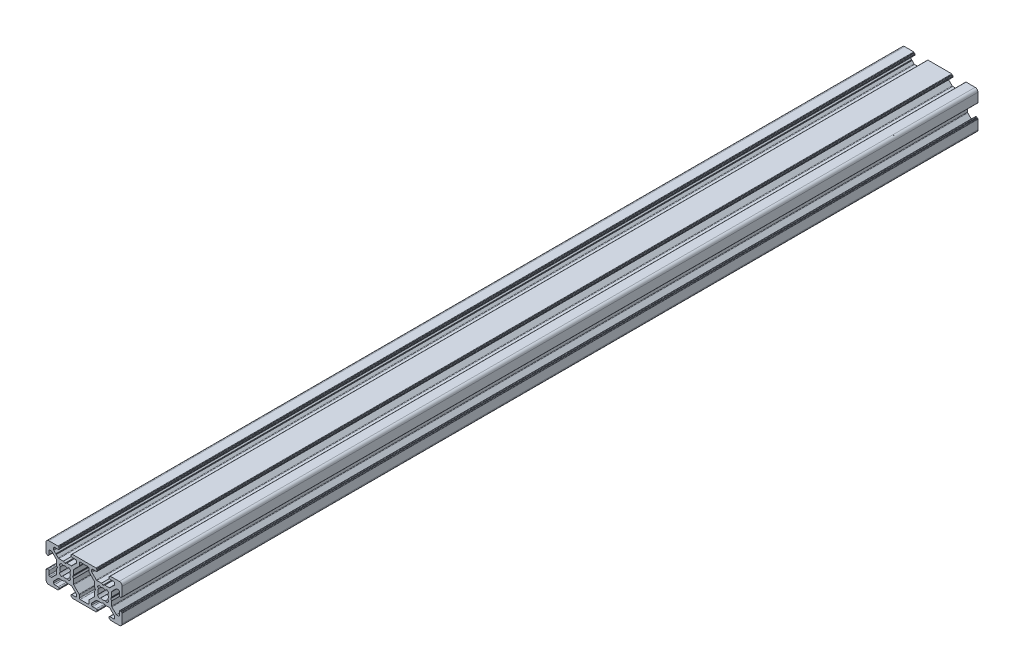
from build123d import *

# Parameters (mm, degrees)
EXTRUDE_830_DEPTH = 224.75


with BuildPart() as part:
    # Model → Extrude 830 (new, symmetric)
    with BuildSketch(Plane.XY):
        with BuildLine():
            Line((-14.790380224, 5.709619137), (-14.842144033, 5.902804302))
            Line((-14.842144033, 5.902804302), (-15.853552994, 6.914213263))
            ThreePointArc((-15.853552994, 6.914213263), (-15.96193937, 7.076424937), (-15.999999604, 7.267766654))
            Line((-15.999999604, 7.267766654), (-15.999999604, 7.999999642))
            ThreePointArc((-15.999999604, 7.999999642), (-15.853552994, 8.353553033), (-15.499999604, 8.499999642))
            Line((-15.499999604, 8.499999642), (-13.599999999, 8.499999642))
            ThreePointArc((-13.599999999, 8.499999642), (-13.246446608, 8.646446251), (-13.099999999, 8.999999642))
            Line((-13.099999999, 8.999999642), (-13.099999999, 9.299999969))
            ThreePointArc((-13.099999999, 9.299999969), (-13.158578643, 9.441421325), (-13.299999999, 9.499999969))
            Line((-13.299999999, 9.499999969), (-13.350000227, 9.499999969))
            ThreePointArc((-13.350000227, 9.499999969), (-13.491421583, 9.558578612), (-13.550000227, 9.699999969))
            Line((-13.550000227, 9.699999969), (-13.550000227, 9.799999969))
            ThreePointArc((-13.550000227, 9.799999969), (-13.60857887, 9.941421325), (-13.750000227, 9.999999969))
            Line((-13.750000227, 9.999999969), (-18.499999999, 9.999999969))
            ThreePointArc((-18.499999999, 9.999999969), (-19.560660171, 9.56066014), (-19.999999999, 8.499999969))
            Line((-19.999999999, 8.499999969), (-19.999999999, 3.750000196))
            ThreePointArc((-19.999999999, 3.750000196), (-19.941421355, 3.60857884), (-19.799999999, 3.550000196))
            Line((-19.799999999, 3.550000196), (-19.699999999, 3.550000196))
            ThreePointArc((-19.699999999, 3.550000196), (-19.558578643, 3.491421552), (-19.499999999, 3.350000196))
            Line((-19.499999999, 3.350000196), (-19.499999999, 3.299999969))
            ThreePointArc((-19.499999999, 3.299999969), (-19.441421355, 3.158578612), (-19.299999999, 3.099999969))
            Line((-19.299999999, 3.099999969), (-18.999999672, 3.099999969))
            ThreePointArc((-18.999999672, 3.099999969), (-18.646446282, 3.246446578), (-18.499999672, 3.599999969))
            Line((-18.499999672, 3.599999969), (-18.499999672, 5.500000655))
            ThreePointArc((-18.499999672, 5.500000655), (-18.353553063, 5.853554045), (-17.999999672, 6.000000655))
            Line((-17.999999672, 6.000000655), (-17.267766625, 6.000000655))
            ThreePointArc((-17.267766625, 6.000000655), (-17.076424898, 5.961940416), (-16.914213218, 5.853554028))
            Line((-16.914213218, 5.853554028), (-14.646446591, 3.585787181))
            ThreePointArc((-14.646446591, 3.585787181), (-14.538060228, 3.423575512), (-14.499999999, 3.232233807))
            Line((-14.499999999, 3.232233807), (-14.499999999, 0.95359028))
            ThreePointArc((-14.499999999, 0.95359028), (-14.493185165, 0.901826474), (-14.473205082, 0.853590285))
            Line((-14.473205082, 0.853590285), (-14.038119561, 0.100000013))
            ThreePointArc((-14.038119561, 0.100000013), (-14.011324631, -3.1e-08), (-14.038119561, -0.100000076))
            Line((-14.038119561, -0.100000076), (-14.473205082, -0.853590347))
            ThreePointArc((-14.473205082, -0.853590347), (-14.493185165, -0.901826537), (-14.499999999, -0.953590343))
            Line((-14.499999999, -0.953590343), (-14.499999999, -3.23223387))
            ThreePointArc((-14.499999999, -3.23223387), (-14.538060228, -3.423575575), (-14.646446591, -3.585787243))
            Line((-14.646446591, -3.585787243), (-16.914213218, -5.853554091))
            ThreePointArc((-16.914213218, -5.853554091), (-17.076424898, -5.961940479), (-17.267766625, -6.000000717))
            Line((-17.267766625, -6.000000717), (-17.999999672, -6.000000717))
            ThreePointArc((-17.999999672, -6.000000717), (-18.353553063, -5.853554108), (-18.499999672, -5.500000717))
            Line((-18.499999672, -5.500000717), (-18.499999672, -3.600000031))
            ThreePointArc((-18.499999672, -3.600000031), (-18.646446282, -3.246446641), (-18.999999672, -3.100000031))
            Line((-18.999999672, -3.100000031), (-19.299999999, -3.100000031))
            ThreePointArc((-19.299999999, -3.100000031), (-19.441421355, -3.158578675), (-19.499999999, -3.300000031))
            Line((-19.499999999, -3.300000031), (-19.499999999, -3.350000259))
            ThreePointArc((-19.499999999, -3.350000259), (-19.558578643, -3.491421615), (-19.699999999, -3.550000259))
            Line((-19.699999999, -3.550000259), (-19.799999999, -3.550000259))
            ThreePointArc((-19.799999999, -3.550000259), (-19.941421355, -3.608578903), (-19.999999999, -3.750000259))
            Line((-19.999999999, -3.750000259), (-19.999999999, -8.500000031))
            ThreePointArc((-19.999999999, -8.500000031), (-19.560660171, -9.560660203), (-18.499999999, -10.000000031))
            Line((-18.499999999, -10.000000031), (-13.750000227, -10.000000031))
            ThreePointArc((-13.750000227, -10.000000031), (-13.60857887, -9.941421388), (-13.550000227, -9.800000031))
            Line((-13.550000227, -9.800000031), (-13.550000227, -9.700000031))
            ThreePointArc((-13.550000227, -9.700000031), (-13.491421583, -9.558578675), (-13.350000227, -9.500000031))
            Line((-13.350000227, -9.500000031), (-13.299999999, -9.500000031))
            ThreePointArc((-13.299999999, -9.500000031), (-13.158578643, -9.441421388), (-13.099999999, -9.300000031))
            Line((-13.099999999, -9.300000031), (-13.099999999, -8.999999705))
            ThreePointArc((-13.099999999, -8.999999705), (-13.246446608, -8.646446314), (-13.599999999, -8.499999705))
            Line((-13.599999999, -8.499999705), (-15.499999604, -8.499999705))
            ThreePointArc((-15.499999604, -8.499999705), (-15.853552994, -8.353553095), (-15.999999604, -7.999999705))
            Line((-15.999999604, -7.999999705), (-15.999999604, -7.267766658))
            ThreePointArc((-15.999999604, -7.267766658), (-15.96193937, -7.076424942), (-15.853552994, -6.914213267))
            Line((-15.853552994, -6.914213267), (-13.585786098, -4.646446371))
            ThreePointArc((-13.585786098, -4.646446371), (-13.423574424, -4.538059995), (-13.232232708, -4.499999762))
            Line((-13.232232708, -4.499999762), (-10.953589301, -4.499999762))
            ThreePointArc((-10.953589301, -4.499999762), (-10.901825489, -4.493184926), (-10.853589297, -4.47320484))
            Line((-10.853589297, -4.47320484), (-10.099999968, -4.038119814))
            ThreePointArc((-10.099999968, -4.038119814), (-9.999999999, -4.011324902), (-9.90000003, -4.038119814))
            Line((-9.90000003, -4.038119814), (-9.146410702, -4.47320484))
            ThreePointArc((-9.146410702, -4.47320484), (-9.098174509, -4.493184926), (-9.046410697, -4.499999762))
            Line((-9.046410697, -4.499999762), (-6.767767291, -4.499999762))
            ThreePointArc((-6.767767291, -4.499999762), (-6.576425574, -4.538059995), (-6.4142139, -4.646446371))
            Line((-6.4142139, -4.646446371), (-4.146447004, -6.914213267))
            ThreePointArc((-4.146447004, -6.914213267), (-4.038060628, -7.076424942), (-4.000000394, -7.267766658))
            Line((-4.000000394, -7.267766658), (-4.000000394, -7.999999646))
            ThreePointArc((-4.000000394, -7.999999646), (-4.146447004, -8.353553037), (-4.500000394, -8.499999646))
            Line((-4.500000394, -8.499999646), (-6.399999999, -8.499999646))
            ThreePointArc((-6.399999999, -8.499999646), (-6.75355339, -8.646446255), (-6.899999999, -8.999999646))
            Line((-6.899999999, -8.999999646), (-6.899999999, -9.299999973))
            ThreePointArc((-6.899999999, -9.299999973), (-6.841421355, -9.441421329), (-6.699999999, -9.499999973))
            Line((-6.699999999, -9.499999973), (-6.649999772, -9.499999973))
            ThreePointArc((-6.649999772, -9.499999973), (-6.508578415, -9.558578616), (-6.449999772, -9.699999973))
            Line((-6.449999772, -9.699999973), (-6.449999772, -9.799999973))
            ThreePointArc((-6.449999772, -9.799999973), (-6.391421128, -9.941421329), (-6.249999772, -9.999999973))
            Line((-6.249999772, -9.999999973), (6.249999773, -9.999999973))
            ThreePointArc((6.249999773, -9.999999973), (6.39142113, -9.941421329), (6.449999773, -9.799999973))
            Line((6.449999773, -9.799999973), (6.449999773, -9.699999973))
            ThreePointArc((6.449999773, -9.699999973), (6.508578417, -9.558578616), (6.649999773, -9.499999973))
            Line((6.649999773, -9.499999973), (6.700000001, -9.499999973))
            ThreePointArc((6.700000001, -9.499999973), (6.841421357, -9.441421329), (6.900000001, -9.299999973))
            Line((6.900000001, -9.299999973), (6.900000001, -8.999999646))
            ThreePointArc((6.900000001, -8.999999646), (6.753553392, -8.646446255), (6.400000001, -8.499999646))
            Line((6.400000001, -8.499999646), (4.500000396, -8.499999646))
            ThreePointArc((4.500000396, -8.499999646), (4.146447006, -8.353553037), (4.000000396, -7.999999646))
            Line((4.000000396, -7.999999646), (4.000000396, -7.267766658))
            ThreePointArc((4.000000396, -7.267766658), (4.03806063, -7.076424942), (4.146447006, -6.914213267))
            Line((4.146447006, -6.914213267), (6.414213902, -4.646446371))
            ThreePointArc((6.414213902, -4.646446371), (6.576425576, -4.538059995), (6.767767292, -4.499999762))
            Line((6.767767292, -4.499999762), (9.046410699, -4.499999762))
            ThreePointArc((9.046410699, -4.499999762), (9.098174511, -4.493184926), (9.146410703, -4.47320484))
            Line((9.146410703, -4.47320484), (9.900000032, -4.038119814))
            ThreePointArc((9.900000032, -4.038119814), (10.000000001, -4.011324902), (10.09999997, -4.038119814))
            Line((10.09999997, -4.038119814), (10.853589298, -4.47320484))
            ThreePointArc((10.853589298, -4.47320484), (10.901825491, -4.493184926), (10.953589303, -4.499999762))
            Line((10.953589303, -4.499999762), (13.232232709, -4.499999762))
            ThreePointArc((13.232232709, -4.499999762), (13.423574426, -4.538059995), (13.5857861, -4.646446371))
            Line((13.5857861, -4.646446371), (15.853552996, -6.914213267))
            ThreePointArc((15.853552996, -6.914213267), (15.961939372, -7.076424942), (15.999999606, -7.267766658))
            Line((15.999999606, -7.267766658), (15.999999606, -7.999999705))
            ThreePointArc((15.999999606, -7.999999705), (15.853552996, -8.353553095), (15.499999606, -8.499999705))
            Line((15.499999606, -8.499999705), (13.600000001, -8.499999705))
            ThreePointArc((13.600000001, -8.499999705), (13.24644661, -8.646446314), (13.100000001, -8.999999705))
            Line((13.100000001, -8.999999705), (13.100000001, -9.300000031))
            ThreePointArc((13.100000001, -9.300000031), (13.158578645, -9.441421388), (13.300000001, -9.500000031))
            Line((13.300000001, -9.500000031), (13.350000228, -9.500000031))
            ThreePointArc((13.350000228, -9.500000031), (13.491421585, -9.558578675), (13.550000228, -9.700000031))
            Line((13.550000228, -9.700000031), (13.550000228, -9.800000031))
            ThreePointArc((13.550000228, -9.800000031), (13.608578872, -9.941421388), (13.750000228, -10.000000031))
            Line((13.750000228, -10.000000031), (18.500000001, -10.000000031))
            ThreePointArc((18.500000001, -10.000000031), (19.560660173, -9.560660203), (20.000000001, -8.500000031))
            Line((20.000000001, -8.500000031), (20.000000001, -3.750000259))
            ThreePointArc((20.000000001, -3.750000259), (19.941421357, -3.608578903), (19.800000001, -3.550000259))
            Line((19.800000001, -3.550000259), (19.700000001, -3.550000259))
            ThreePointArc((19.700000001, -3.550000259), (19.558578645, -3.491421615), (19.500000001, -3.350000259))
            Line((19.500000001, -3.350000259), (19.500000001, -3.300000031))
            ThreePointArc((19.500000001, -3.300000031), (19.441421357, -3.158578675), (19.300000001, -3.100000031))
            Line((19.300000001, -3.100000031), (18.999999674, -3.100000031))
            ThreePointArc((18.999999674, -3.100000031), (18.646446284, -3.246446641), (18.499999674, -3.600000031))
            Line((18.499999674, -3.600000031), (18.499999674, -5.500000717))
            ThreePointArc((18.499999674, -5.500000717), (18.353553065, -5.853554108), (17.999999674, -6.000000717))
            Line((17.999999674, -6.000000717), (17.267766627, -6.000000717))
            ThreePointArc((17.267766627, -6.000000717), (17.0764249, -5.961940479), (16.914213219, -5.853554091))
            Line((16.914213219, -5.853554091), (14.646446593, -3.585787243))
            ThreePointArc((14.646446593, -3.585787243), (14.53806023, -3.423575575), (14.500000001, -3.23223387))
            Line((14.500000001, -3.23223387), (14.500000001, -0.953590343))
            ThreePointArc((14.500000001, -0.953590343), (14.493185167, -0.901826537), (14.473205084, -0.853590347))
            Line((14.473205084, -0.853590347), (14.038119563, -0.100000076))
            ThreePointArc((14.038119563, -0.100000076), (14.011324633, -3.1e-08), (14.038119563, 0.100000013))
            Line((14.038119563, 0.100000013), (14.473205084, 0.853590285))
            ThreePointArc((14.473205084, 0.853590285), (14.493185167, 0.901826474), (14.500000001, 0.95359028))
            Line((14.500000001, 0.95359028), (14.500000001, 3.232233807))
            ThreePointArc((14.500000001, 3.232233807), (14.53806023, 3.423575512), (14.646446593, 3.585787181))
            Line((14.646446593, 3.585787181), (16.914213219, 5.853554028))
            ThreePointArc((16.914213219, 5.853554028), (17.0764249, 5.961940416), (17.267766627, 6.000000655))
            Line((17.267766627, 6.000000655), (17.999999674, 6.000000655))
            ThreePointArc((17.999999674, 6.000000655), (18.353553065, 5.853554045), (18.499999674, 5.500000655))
            Line((18.499999674, 5.500000655), (18.499999674, 3.599999969))
            ThreePointArc((18.499999674, 3.599999969), (18.646446284, 3.246446578), (18.999999674, 3.099999969))
            Line((18.999999674, 3.099999969), (19.300000001, 3.099999969))
            ThreePointArc((19.300000001, 3.099999969), (19.441421357, 3.158578612), (19.500000001, 3.299999969))
            Line((19.500000001, 3.299999969), (19.500000001, 3.350000196))
            ThreePointArc((19.500000001, 3.350000196), (19.558578645, 3.491421552), (19.700000001, 3.550000196))
            Line((19.700000001, 3.550000196), (19.800000001, 3.550000196))
            ThreePointArc((19.800000001, 3.550000196), (19.941421357, 3.60857884), (20.000000001, 3.750000196))
            Line((20.000000001, 3.750000196), (20.000000001, 8.499999969))
            ThreePointArc((20.000000001, 8.499999969), (19.560660173, 9.56066014), (18.500000001, 9.999999969))
            Line((18.500000001, 9.999999969), (13.750000228, 9.999999969))
            ThreePointArc((13.750000228, 9.999999969), (13.608578872, 9.941421325), (13.550000228, 9.799999969))
            Line((13.550000228, 9.799999969), (13.550000228, 9.699999969))
            ThreePointArc((13.550000228, 9.699999969), (13.491421585, 9.558578612), (13.350000228, 9.499999969))
            Line((13.350000228, 9.499999969), (13.300000001, 9.499999969))
            ThreePointArc((13.300000001, 9.499999969), (13.158578645, 9.441421325), (13.100000001, 9.299999969))
            Line((13.100000001, 9.299999969), (13.100000001, 8.999999642))
            ThreePointArc((13.100000001, 8.999999642), (13.24644661, 8.646446251), (13.600000001, 8.499999642))
            Line((13.600000001, 8.499999642), (15.499999606, 8.499999642))
            ThreePointArc((15.499999606, 8.499999642), (15.853552996, 8.353553033), (15.999999606, 7.999999642))
            Line((15.999999606, 7.999999642), (15.999999606, 7.267766654))
            ThreePointArc((15.999999606, 7.267766654), (15.961939372, 7.076424937), (15.853552996, 6.914213263))
            Line((15.853552996, 6.914213263), (13.5857861, 4.646446367))
            ThreePointArc((13.5857861, 4.646446367), (13.423574426, 4.538059991), (13.232232709, 4.499999757))
            Line((13.232232709, 4.499999757), (10.953589303, 4.499999757))
            ThreePointArc((10.953589303, 4.499999757), (10.901825491, 4.493184922), (10.853589298, 4.473204836))
            Line((10.853589298, 4.473204836), (10.09999997, 4.03811981))
            ThreePointArc((10.09999997, 4.03811981), (10.000000001, 4.011324897), (9.900000032, 4.03811981))
            Line((9.900000032, 4.03811981), (9.146410703, 4.473204836))
            ThreePointArc((9.146410703, 4.473204836), (9.098174511, 4.493184922), (9.046410699, 4.499999757))
            Line((9.046410699, 4.499999757), (6.767767292, 4.499999757))
            ThreePointArc((6.767767292, 4.499999757), (6.576425576, 4.538059991), (6.414213902, 4.646446367))
            Line((6.414213902, 4.646446367), (4.146447006, 6.914213263))
            ThreePointArc((4.146447006, 6.914213263), (4.03806063, 7.076424937), (4.000000396, 7.267766654))
            Line((4.000000396, 7.267766654), (4.000000396, 7.999999734))
            ThreePointArc((4.000000396, 7.999999734), (4.146446629, 8.35355271), (4.499999315, 8.499999642))
            Line((4.499999315, 8.499999642), (6.400000001, 8.499999642))
            ThreePointArc((6.400000001, 8.499999642), (6.753553392, 8.646446251), (6.900000001, 8.999999642))
            Line((6.900000001, 8.999999642), (6.900000001, 9.299999969))
            ThreePointArc((6.900000001, 9.299999969), (6.841421357, 9.441421325), (6.700000001, 9.499999969))
            Line((6.700000001, 9.499999969), (6.649999773, 9.499999969))
            ThreePointArc((6.649999773, 9.499999969), (6.508578417, 9.558578612), (6.449999773, 9.699999969))
            Line((6.449999773, 9.699999969), (6.449999773, 9.799999969))
            ThreePointArc((6.449999773, 9.799999969), (6.39142113, 9.941421325), (6.249999773, 9.999999969))
            Line((6.249999773, 9.999999969), (-6.249999772, 9.999999969))
            ThreePointArc((-6.249999772, 9.999999969), (-6.391421128, 9.941421325), (-6.449999772, 9.799999969))
            Line((-6.449999772, 9.799999969), (-6.449999772, 9.699999969))
            ThreePointArc((-6.449999772, 9.699999969), (-6.508578415, 9.558578612), (-6.649999772, 9.499999969))
            Line((-6.649999772, 9.499999969), (-6.699999999, 9.499999969))
            ThreePointArc((-6.699999999, 9.499999969), (-6.841421355, 9.441421325), (-6.899999999, 9.299999969))
            Line((-6.899999999, 9.299999969), (-6.899999999, 8.999999642))
            ThreePointArc((-6.899999999, 8.999999642), (-6.75355339, 8.646446251), (-6.399999999, 8.499999642))
            Line((-6.399999999, 8.499999642), (-4.500000302, 8.499999642))
            ThreePointArc((-4.500000302, 8.499999642), (-4.146446965, 8.353553048), (-4.000000394, 7.999999701))
            Line((-4.000000394, 7.999999701), (-4.000000394, 7.267766654))
            ThreePointArc((-4.000000394, 7.267766654), (-4.038060628, 7.076424937), (-4.146447004, 6.914213263))
            Line((-4.146447004, 6.914213263), (-6.4142139, 4.646446367))
            ThreePointArc((-6.4142139, 4.646446367), (-6.576425574, 4.538059991), (-6.767767291, 4.499999757))
            Line((-6.767767291, 4.499999757), (-9.046410697, 4.499999757))
            ThreePointArc((-9.046410697, 4.499999757), (-9.098174509, 4.493184922), (-9.146410702, 4.473204836))
            Line((-9.146410702, 4.473204836), (-9.90000003, 4.03811981))
            ThreePointArc((-9.90000003, 4.03811981), (-9.999999999, 4.011324897), (-10.099999968, 4.03811981))
            Line((-10.099999968, 4.03811981), (-10.853589297, 4.473204836))
            ThreePointArc((-10.853589297, 4.473204836), (-10.901825489, 4.493184922), (-10.953589301, 4.499999757))
            Line((-10.953589301, 4.499999757), (-13.232232708, 4.499999757))
            ThreePointArc((-13.232232708, 4.499999757), (-13.423574424, 4.538059991), (-13.585786098, 4.646446367))
            Line((-13.585786098, 4.646446367), (-14.597195059, 5.657855328))
            Line((-14.597195059, 5.657855328), (-14.790380224, 5.709619137))
        make_face()
        with BuildLine():
            Line((8.090069039, 2.992174922), (8.741814684, 2.445295392))
            ThreePointArc((8.741814684, 2.445295392), (10.000000001, 2.749999969), (11.258185318, 2.445295392))
            Line((11.258185318, 2.445295392), (11.909930962, 2.992174922))
            ThreePointArc((11.909930962, 2.992174922), (12.508410486, 2.511737229), (12.989640963, 1.913894988))
            Line((12.989640963, 1.913894988), (12.445295363, 1.258185405))
            ThreePointArc((12.445295363, 1.258185405), (12.750000001, -3.1e-08), (12.445295363, -1.258185468))
            Line((12.445295363, -1.258185468), (12.989640963, -1.913895051))
            ThreePointArc((12.989640963, -1.913895051), (12.508410486, -2.511737292), (11.909930962, -2.992174985))
            Line((11.909930962, -2.992174985), (11.258185318, -2.445295455))
            ThreePointArc((11.258185318, -2.445295455), (10.000000001, -2.750000031), (8.741814684, -2.445295455))
            Line((8.741814684, -2.445295455), (8.090069039, -2.992174985))
            ThreePointArc((8.090069039, -2.992174985), (7.491589516, -2.511737292), (7.010359039, -1.913895051))
            Line((7.010359039, -1.913895051), (7.554704639, -1.258185468))
            ThreePointArc((7.554704639, -1.258185468), (7.250000001, -3.1e-08), (7.554704639, 1.258185405))
            Line((7.554704639, 1.258185405), (7.010359039, 1.913894988))
            ThreePointArc((7.010359039, 1.913894988), (7.491589516, 2.511737229), (8.090069039, 2.992174922))
        make_face(mode=Mode.SUBTRACT)
        with BuildLine():
            Line((-7.010359037, 1.913894988), (-7.554704637, 1.258185405))
            ThreePointArc((-7.554704637, 1.258185405), (-7.249999999, -3.1e-08), (-7.554704637, -1.258185468))
            Line((-7.554704637, -1.258185468), (-7.010359037, -1.913895051))
            ThreePointArc((-7.010359037, -1.913895051), (-7.491589514, -2.511737292), (-8.090069038, -2.992174985))
            Line((-8.090069038, -2.992174985), (-8.741814682, -2.445295455))
            ThreePointArc((-8.741814682, -2.445295455), (-9.999999999, -2.750000031), (-11.258185316, -2.445295455))
            Line((-11.258185316, -2.445295455), (-11.909930961, -2.992174985))
            ThreePointArc((-11.909930961, -2.992174985), (-12.508410484, -2.511737292), (-12.989640961, -1.913895051))
            Line((-12.989640961, -1.913895051), (-12.445295361, -1.258185468))
            ThreePointArc((-12.445295361, -1.258185468), (-12.749999999, -3.1e-08), (-12.445295361, 1.258185405))
            Line((-12.445295361, 1.258185405), (-12.989640961, 1.913894988))
            ThreePointArc((-12.989640961, 1.913894988), (-12.508410484, 2.511737229), (-11.909930961, 2.992174922))
            Line((-11.909930961, 2.992174922), (-11.258185316, 2.445295392))
            ThreePointArc((-11.258185316, 2.445295392), (-9.999999999, 2.749999969), (-8.741814682, 2.445295392))
            Line((-8.741814682, 2.445295392), (-8.090069038, 2.992174922))
            ThreePointArc((-8.090069038, 2.992174922), (-7.491589514, 2.511737229), (-7.010359037, 1.913894988))
        make_face(mode=Mode.SUBTRACT)
        with BuildLine():
            Line((5.526682017, 0.85378582), (5.961880479, 0.100000015))
            ThreePointArc((5.961880479, 0.100000015), (5.988675404, 4e-09), (5.961880483, -0.100000009))
            Line((5.961880483, -0.100000009), (5.526682014, -0.853785889))
            ThreePointArc((5.526682014, -0.853785889), (5.50670193, -0.902022079), (5.499887096, -0.953785887))
            Line((5.499887096, -0.953785887), (5.499887096, -3.232425683))
            ThreePointArc((5.499887096, -3.232425683), (5.461825468, -3.423770765), (5.353435334, -3.585984226))
            Line((5.353435334, -3.585984226), (2.646451763, -6.292888902))
            ThreePointArc((2.646451763, -6.292888902), (2.538061629, -6.455102363), (2.500000001, -6.646447445))
            Line((2.500000001, -6.646447445), (2.500000001, -7.99999982))
            ThreePointArc((2.500000001, -7.99999982), (2.353553392, -8.35355321), (2.000000001, -8.49999982))
            Line((2.000000001, -8.49999982), (-1.999999999, -8.49999982))
            ThreePointArc((-1.999999999, -8.49999982), (-2.35355339, -8.35355321), (-2.499999999, -7.99999982))
            Line((-2.499999999, -7.99999982), (-2.499999999, -6.646447445))
            ThreePointArc((-2.499999999, -6.646447445), (-2.538060306, -6.455105552), (-2.646446878, -6.292893784))
            Line((-2.646446878, -6.292893784), (-5.353542339, -3.585802459))
            ThreePointArc((-5.353542339, -3.585802459), (-5.461928911, -3.423590691), (-5.499989218, -3.232248799))
            Line((-5.499989218, -3.232248799), (-5.499989218, -0.953609003))
            ThreePointArc((-5.499989218, -0.953609003), (-5.506804053, -0.901845195), (-5.526784136, -0.853609005))
            Line((-5.526784136, -0.853609005), (-5.961880481, -0.100000009))
            ThreePointArc((-5.961880481, -0.100000009), (-5.988675402, 4e-09), (-5.961880477, 0.100000015))
            Line((-5.961880477, 0.100000015), (-5.52678414, 0.853608936))
            ThreePointArc((-5.52678414, 0.853608936), (-5.506804054, 0.901845129), (-5.499989218, 0.95360894))
            Line((-5.499989218, 0.95360894), (-5.499989218, 3.232248736))
            ThreePointArc((-5.499989218, 3.232248736), (-5.461928911, 3.423590629), (-5.353542339, 3.585802397))
            Line((-5.353542339, 3.585802397), (-2.64644716, 6.29289344))
            ThreePointArc((-2.64644716, 6.29289344), (-2.538060587, 6.455105208), (-2.50000028, 6.646447101))
            Line((-2.50000028, 6.646447101), (-2.50000028, 7.999999757))
            ThreePointArc((-2.50000028, 7.999999757), (-2.353553671, 8.353553147), (-2.00000028, 8.499999757))
            Line((-2.00000028, 8.499999757), (2.00000028, 8.499999757))
            ThreePointArc((2.00000028, 8.499999757), (2.353553671, 8.353553147), (2.50000028, 7.999999757))
            Line((2.50000028, 7.999999757), (2.50000028, 6.646447103))
            ThreePointArc((2.50000028, 6.646447103), (2.538061908, 6.455102021), (2.646452042, 6.29288856))
            Line((2.646452042, 6.29288856), (5.353435334, 3.585984163))
            ThreePointArc((5.353435334, 3.585984163), (5.461825468, 3.423770703), (5.499887096, 3.232425621))
            Line((5.499887096, 3.232425621), (5.499887096, 0.953785825))
            ThreePointArc((5.499887096, 0.953785825), (5.506701931, 0.902022013), (5.526682017, 0.85378582))
        make_face(mode=Mode.SUBTRACT)
    extrude(amount=EXTRUDE_830_DEPTH, both=True)


solid = part.part
